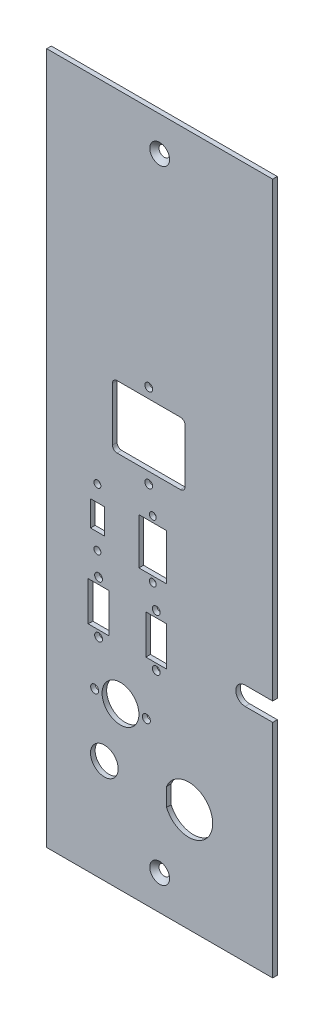
from build123d import *

# Parameters (mm, degrees)
SKIZZE2_W                                   = 98
SKIZZE2_H                                   = 300
AUFSATZ_LINEAR_AUSTRAGEN1_DEPTH             = 2
FORMSENKUNG_F_R_M4_SENKSCHRAUBE_MIT_2_COUNT = 2
FORMSENKUNG_F_R_M4_SENKSCHRAUBE_MIT_2_PITCH = 270
SKIZZE6_R                                   = 1.7
SKIZZE6_R_2                                 = 8
SKIZZE6_R_3                                 = 1.5
SKIZZE6_R_4                                 = 6
SKIZZE6_R_5                                 = 1.75
SKIZZE6_W                                   = 9
SKIZZE6_H                                   = 17
SKIZZE6_W_2                                 = 12
SKIZZE6_H_2                                 = 20
SKIZZE6_W_3                                 = 6
SKIZZE6_H_3                                 = 11
SCHNITT_LINEAR_AUSTRAGEN1_DEPTH             = 10


with BuildPart() as part:
    # Skizze2 → Aufsatz-Linear austragen1 (new body)
    with BuildSketch(Plane.XY):
        with Locations((46, -55.288461538)):
            Rectangle(SKIZZE2_W, SKIZZE2_H)
    extrude(amount=AUFSATZ_LINEAR_AUSTRAGEN1_DEPTH)

    # Skizze4 → Formsenkung für M4 Senkschraube mit Innensechskant1 (revolve, cut)
    with BuildSketch(Plane(origin=(46, 79.711538462, 2), x_dir=(0, -1, 0), z_dir=(1, 0, 0))):
        Polygon((0, 0), (0, 2), (2.25, 2), (2.25, 2.05), (4.3, 0), align=None)
    formsenkung_f_r_m4_senkschraube_mit_inne = revolve(axis=Axis((46, 79.711538462, 8.35), (0, 0, -1)), mode=Mode.SUBTRACT)

    # Formsenkung f_r M4 Senkschraube mit  2: Formsenkung für M4 Senkschraube mit Innensechskant1 ×2
    with Locations(*[(0, -i * FORMSENKUNG_F_R_M4_SENKSCHRAUBE_MIT_2_PITCH, 0) for i in range(1, FORMSENKUNG_F_R_M4_SENKSCHRAUBE_MIT_2_COUNT)]):
        add(formsenkung_f_r_m4_senkschraube_mit_inne, mode=Mode.SUBTRACT)

    # Skizze6 → Schnitt-Linear austragen1 (cut)
    with BuildSketch(Plane.XY.offset(2)):
        with Locations((41.25, -10.288461538)):
            Circle(SKIZZE6_R)
        with Locations((41.25, -46.688461538)):
            Circle(SKIZZE6_R)
        with Locations((44.5, -92.538461538)):
            Circle(SKIZZE6_R)
        with Locations((44.5, -115.038461538)):
            Circle(SKIZZE6_R)
        with Locations((29, -135.288461538)):
            Circle(SKIZZE6_R_2)
        with Locations((43, -57.788461538)):
            Circle(SKIZZE6_R_3)
        with Locations((43, -82.788461538)):
            Circle(SKIZZE6_R_3)
        with Locations((22, -160.288461538)):
            Circle(SKIZZE6_R_4)
        with Locations((40.2, -135.288461538)):
            Circle(SKIZZE6_R_5)
        with Locations((17.8, -135.288461538)):
            Circle(SKIZZE6_R_5)
        with Locations((19.5, -115.038461538)):
            Circle(SKIZZE6_R)
        with Locations((19.5, -92.538461538)):
            Circle(SKIZZE6_R)
        with Locations((19, -57.788461538)):
            Circle(SKIZZE6_R_3)
        with Locations((19, -82.788461538)):
            Circle(SKIZZE6_R_3)
        with BuildLine():
            Line((27.5, -14.688461538), (55, -14.688461538))
            ThreePointArc((55, -14.688461538), (56.414213562, -15.274247976), (57, -16.688461538))
            Line((57, -16.688461538), (57, -39.888461538))
            ThreePointArc((57, -39.888461538), (56.414213562, -41.302675101), (55, -41.888461538))
            Line((55, -41.888461538), (27.5, -41.888461538))
            ThreePointArc((27.5, -41.888461538), (26.085786438, -41.302675101), (25.5, -39.888461538))
            Line((25.5, -39.888461538), (25.5, -16.688461538))
            ThreePointArc((25.5, -16.688461538), (26.085786438, -15.274247976), (27.5, -14.688461538))
        make_face()
        with Locations((44.5, -103.788461538)):
            Rectangle(SKIZZE6_W, SKIZZE6_H)
        with Locations((43, -70.288461538)):
            Rectangle(SKIZZE6_W_2, SKIZZE6_H_2)
        with Locations((19, -70.288461538)):
            Rectangle(SKIZZE6_W_3, SKIZZE6_H_3)
        with BuildLine():
            Line((49, -164.223004079), (49, -156.353918998))
            ThreePointArc((49, -156.353918998), (68.975, -160.288461538), (49, -164.223004079))
        make_face()
        with Locations((19.5, -103.788461538)):
            Rectangle(SKIZZE6_W, SKIZZE6_H)
        with BuildLine():
            Line((95, -101.288461538), (83, -101.288461538))
            ThreePointArc((83, -101.288461538), (79, -105.288461538), (83, -109.288461538))
            Line((83, -109.288461538), (95, -109.288461538))
            Line((95, -109.288461538), (95, -101.288461538))
        make_face()
    extrude(amount=-SCHNITT_LINEAR_AUSTRAGEN1_DEPTH, mode=Mode.SUBTRACT)


solid = part.part
